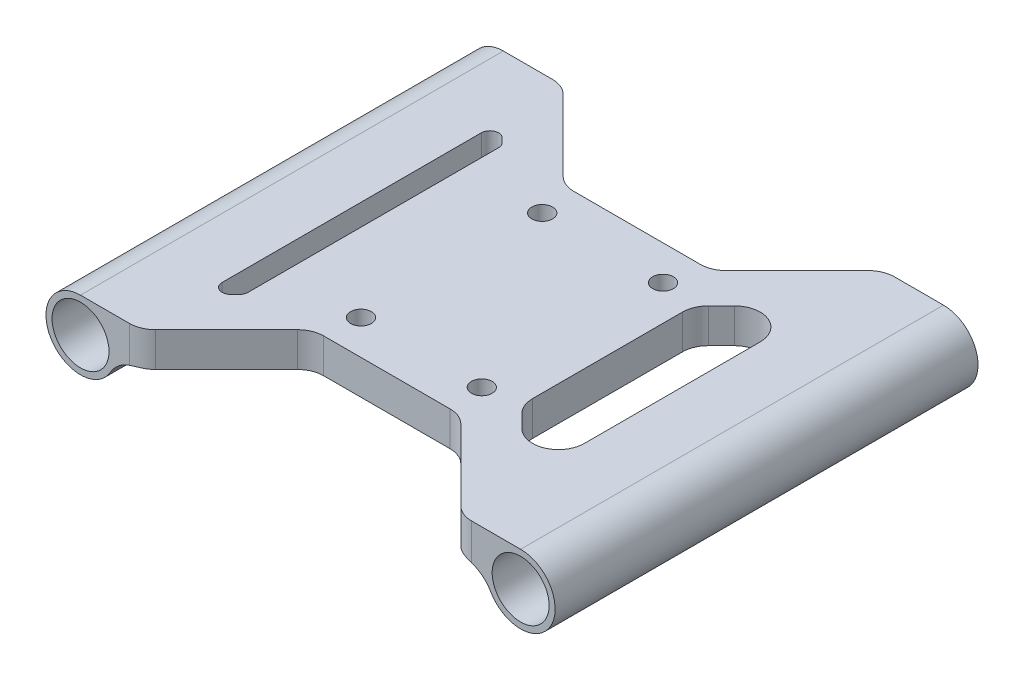
from build123d import *

# Parameters (mm, degrees)
SKETCH1_R               = 4
BOSS_EXTRUDE1_DEPTH     = 24.5
FILLET1_R               = 4
M6_CLEARANCE_HOLE1_D    = 6.6
M2_CLEARANCE_HOLE1_D    = 2.4
CUT_EXTRUDE1_DEPTH      = 40.172694572
CUT_EXTRUDE1_DEPTH_BACK = 40.172694572
FILLET3_R               = 3
FILLET4_R               = 1


with BuildPart() as part:
    # Sketch1 → Boss-Extrude1 (new, symmetric)
    with BuildSketch(Plane.XY):
        with Locations((-25.5, 0)):
            Circle(SKETCH1_R)
        with BuildLine():
            Line((0, 4), (-25.5, 4))
            ThreePointArc((-25.5, 4), (-22.671572875, 2.828427125), (-21.5, 0))
            Line((-21.5, 0), (0, 0))
            Line((0, 0), (0, 4))
        make_face()
        with BuildLine():
            Line((25.5, 4), (0, 4))
            Line((0, 4), (0, 0))
            Line((0, 0), (21.5, 0))
            ThreePointArc((21.5, 0), (22.671572875, 2.828427125), (25.5, 4))
        make_face()
        with Locations((25.5, 0)):
            Circle(SKETCH1_R)
    extrude(amount=BOSS_EXTRUDE1_DEPTH, both=True)

    # Fillet1
    fillet1_edges = [part.edges().sort_by_distance(p)[0] for p in [
        (21.5, 0, 0),
        (-21.5, 0, 0),
    ]]
    fillet(fillet1_edges, radius=FILLET1_R)

    # M6 Clearance Hole1 (through all)
    with Locations(Plane.XY.offset(24.5)):
        with Locations((-25.5, 0), (25.5, 0)):
            Hole(M6_CLEARANCE_HOLE1_D / 2)

    # M2 Clearance Hole1 (through all)
    with Locations(Plane(origin=(0, 4, 0), x_dir=(1, 0, 0), z_dir=(0, 1, 0))):
        with Locations((-7, 10.5), (7, 10.5), (7, -10.5), (-7, -10.5)):
            Hole(M2_CLEARANCE_HOLE1_D / 2)

    # Sketch6 → Cut-Extrude1 (cut, two sides: drawn at the far end of the back side and taken through both)
    with BuildSketch(Plane(origin=(0, 4, 0), x_dir=(1, 0, 0), z_dir=(0, 1, 0)).offset(-CUT_EXTRUDE1_DEPTH_BACK)):
        Polygon((18.57179677, 24.5), (0, 24.5), (0, 14.5), (8.57179677, 14.5), align=None)
        Polygon((0, 24.5), (-18.57179677, 24.5), (-8.57179677, 14.5), (0, 14.5), align=None)
        Polygon((18.57179677, -17.428932188), (11.07179677, -9.928932188), (11.07179677, 9.928932188), (18.57179677, 17.428932188), align=None)
        Polygon((-8.57179677, -14.5), (-18.57179677, -24.5), (18.57179677, -24.5), (8.57179677, -14.5), align=None)
        Polygon((-16.07179677, 14.928932188), (-18.57179677, 17.428932188), (-18.57179677, 0.003413414), (-18.57179677, -0.003413414), (-18.57179677, -17.428932188), (-16.07179677, -14.928932188), align=None)
    extrude(amount=CUT_EXTRUDE1_DEPTH + CUT_EXTRUDE1_DEPTH_BACK, mode=Mode.SUBTRACT)

    # Fillet3
    fillet3_edges = [part.edges().sort_by_distance(p)[0] for p in [
        (18.57179677, 2, -17.428932188),
        (18.57179677, 2, 17.428932188),
        (11.07179677, 2, 9.928932188),
        (11.07179677, 2, -9.928932188),
        (18.57179677, 2, -24.5),
        (8.57179677, 2, -14.5),
        (-8.57179677, 2, -14.5),
        (-18.57179677, 2, -24.5),
        (-8.57179677, 2, 14.5),
        (8.57179677, 2, 14.5),
        (18.57179677, 2, 24.5),
        (-18.57179677, 2, 24.5),
    ]]
    fillet(fillet3_edges, radius=FILLET3_R)

    # Fillet4
    fillet4_edges = [part.edges().sort_by_distance(p)[0] for p in [
        (-18.57179677, 2, 17.428932188),
        (-18.57179677, 2, -17.428932188),
        (-16.07179677, 2, -14.928932188),
        (-16.07179677, 2, 14.928932188),
    ]]
    fillet(fillet4_edges, radius=FILLET4_R)


solid = part.part
